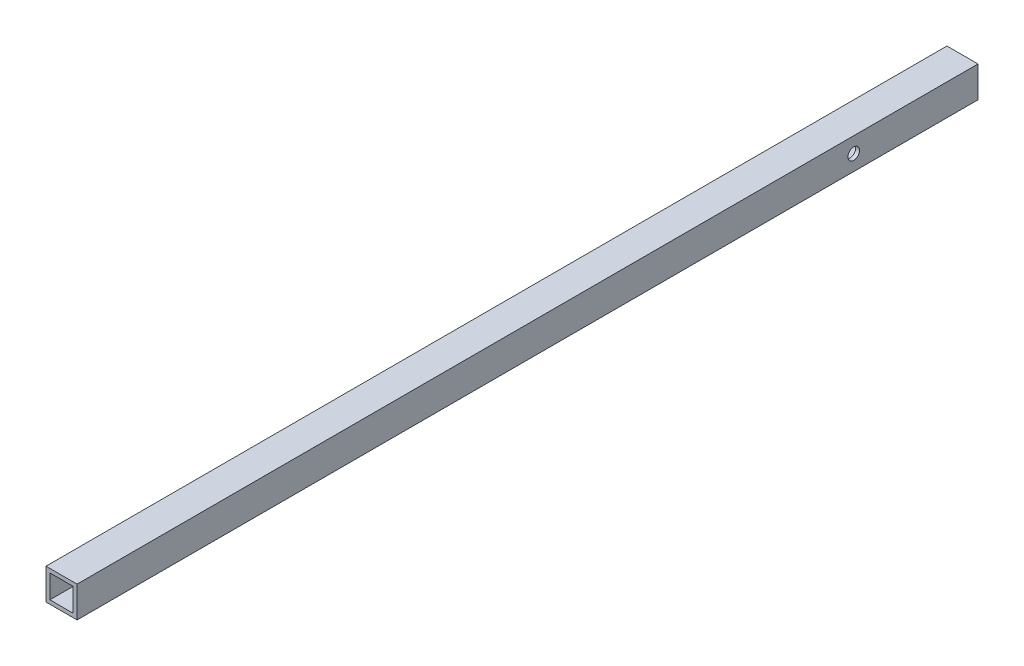
from build123d import *

# Parameters (mm, degrees)
SKETCH1_W           = 25.4
SKETCH1_H           = 25.4
SKETCH1_W_2         = 19.05
SKETCH1_H_2         = 19.05
BOSS_EXTRUDE1_DEPTH = 736.6
SKETCH3_R           = 4.7625
CUT_EXTRUDE1_DEPTH  = 127


with BuildPart() as part:
    # Sketch1 → Boss-Extrude1 (new body)
    with BuildSketch(Plane.XY):
        with Locations((3.05078858, 1.998217396)):
            Rectangle(SKETCH1_W, SKETCH1_H)
        with Locations((3.05078858, 1.998217396)):
            Rectangle(SKETCH1_W_2, SKETCH1_H_2, mode=Mode.SUBTRACT)
    extrude(amount=BOSS_EXTRUDE1_DEPTH)

    # Sketch3 → Cut-Extrude1 (cut)
    with BuildSketch(Plane.ZY.offset(9.64921142)):
        with Locations(Location((101.6, 1.998217396, 0), (0, 0, 270))):
            Circle(SKETCH3_R)
    extrude(amount=-CUT_EXTRUDE1_DEPTH, mode=Mode.SUBTRACT)


solid = part.part
